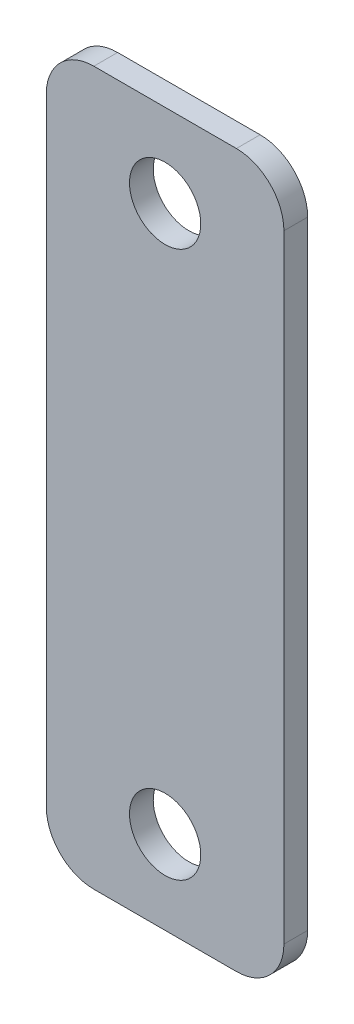
from build123d import *

# Parameters (mm, degrees)
SKETCH_1_W          = 10
SKETCH_1_H          = 30
EXTRUDE_1_DEPTH     = 0.5
SKETCH_2_R          = 1.5
CUT_EXTRUDE_1_DEPTH = 10
FILLET_1_R          = 2


with BuildPart() as part:
    # 草图1 → 凸台-拉伸1 (new, symmetric)
    with BuildSketch(Plane.XY):
        Rectangle(SKETCH_1_W, SKETCH_1_H)
    extrude(amount=EXTRUDE_1_DEPTH, both=True)

    # 草图2 → 切除-拉伸1 (cut)
    with BuildSketch(Plane.XY.offset(0.5)):
        with Locations((0, 11.5)):
            Circle(SKETCH_2_R)
        with Locations((0, -11.5)):
            Circle(SKETCH_2_R)
    extrude(amount=-CUT_EXTRUDE_1_DEPTH, mode=Mode.SUBTRACT)

    # 圆角1
    fillet_1_edges = [part.edges().sort_by_distance(p)[0] for p in [
        (5, -15, 0),
        (-5, -15, 0),
        (-5, 15, 0),
        (5, 15, 0),
    ]]
    fillet(fillet_1_edges, radius=FILLET_1_R)


solid = part.part
